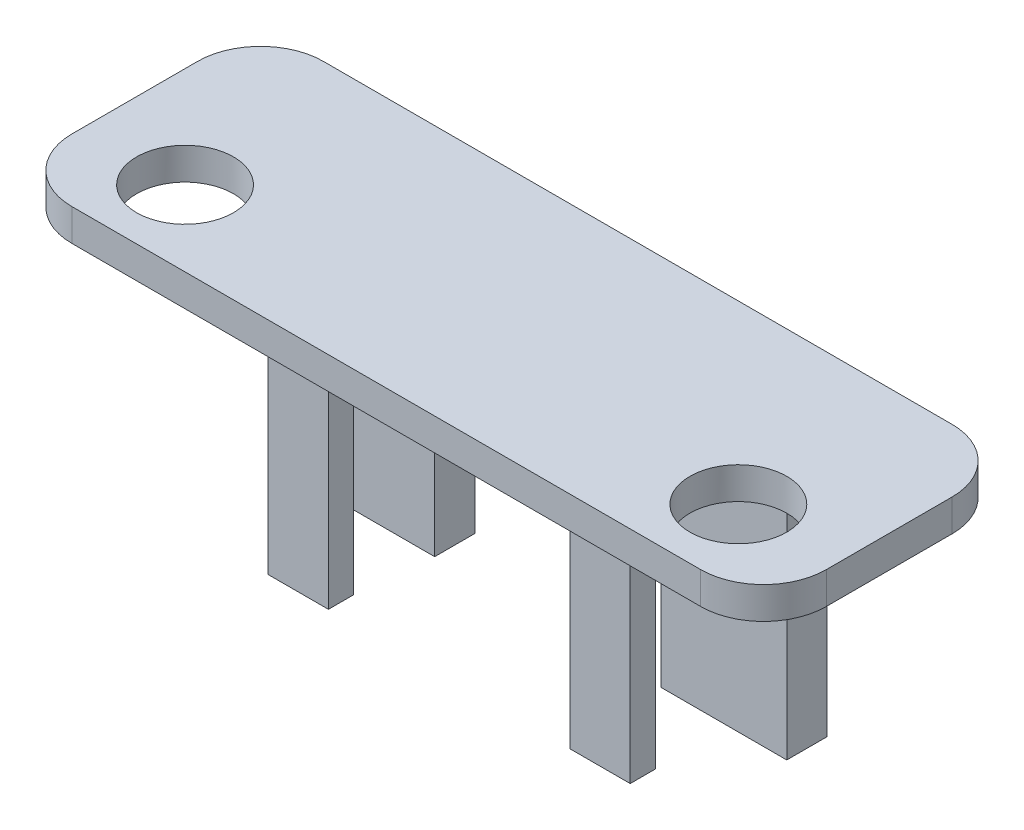
from build123d import *

# Parameters (mm, degrees)
SKETCH1_W            = 60
SKETCH1_H            = 20
BOSS_EXTRUDE1_DEPTH  = 2.54
SKETCH2_R            = 3.85
EYESHAFT_HOLES_DEPTH = 10
SKETCH5_W            = 4.8
SKETCH5_H            = 2
FRONT_LEGS_DEPTH     = 20
SKETCH7_W            = 10
SKETCH7_H            = 3.2
BACK_LEGS_DEPTH      = 20
FILLET2_R            = 5


with BuildPart() as part:
    # Sketch1 → Boss-Extrude1 (new body)
    with BuildSketch(Plane(origin=(0, 0, 0), x_dir=(1, 0, 0), z_dir=(0, 1, 0))):
        Rectangle(SKETCH1_W, SKETCH1_H)
    extrude(amount=BOSS_EXTRUDE1_DEPTH)

    # Sketch2 → Eyeshaft holes (cut)
    with BuildSketch(Plane(origin=(0, 2.54, 0), x_dir=(1, 0, 0), z_dir=(0, 1, 0))):
        with Locations(Location((-22, -4, 0), (0, 0, 270))):
            Circle(SKETCH2_R)
        with Locations(Location((22, -4, 0), (0, 0, 270))):
            Circle(SKETCH2_R)
    extrude(amount=-EYESHAFT_HOLES_DEPTH, mode=Mode.SUBTRACT)

    # Sketch5 → Front Legs (add)
    with BuildSketch(Plane.XZ):
        with Locations((-12, 4)):
            Rectangle(SKETCH5_W, SKETCH5_H)
        with Locations((12, 4)):
            Rectangle(SKETCH5_W, SKETCH5_H)
    extrude(amount=FRONT_LEGS_DEPTH)

    # Sketch7 → Back legs (add)
    with BuildSketch(Plane.XZ):
        with Locations((-14, -4.45)):
            Rectangle(SKETCH7_W, SKETCH7_H)
        with Locations((14, -4.45)):
            Rectangle(SKETCH7_W, SKETCH7_H)
    extrude(amount=BACK_LEGS_DEPTH)

    # Fillet2
    fillet2_edges = [part.edges().sort_by_distance(p)[0] for p in [
        (30, 1.27, 10),
        (-30, 1.27, 10),
        (-30, 1.27, -10),
        (30, 1.27, -10),
    ]]
    fillet(fillet2_edges, radius=FILLET2_R)


solid = part.part
